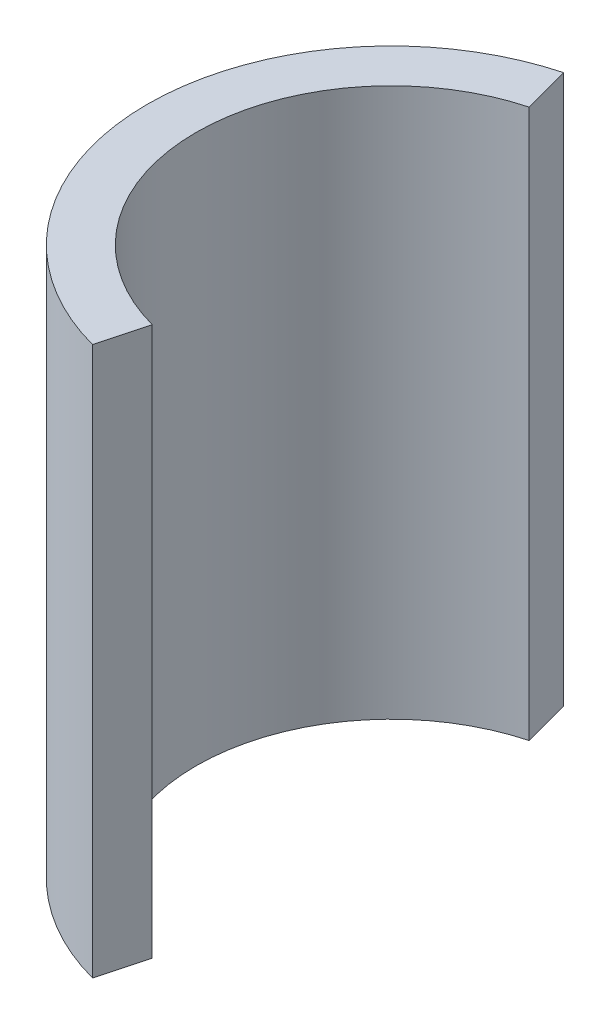
from build123d import *

# Parameters (mm, degrees)
BOSS_EXTRUDE1_DEPTH = 22.5


with BuildPart() as part:
    # Sketch1 → Boss-Extrude1 (new, symmetric)
    with BuildSketch(Plane(origin=(0, 0, 0), x_dir=(1, 0, 0), z_dir=(0, 1, 0))):
        with BuildLine():
            Line((-4.141104722, -15.454813221), (-5.176380902, -19.318516526))
            ThreePointArc((-5.176380902, -19.318516526), (-20, 0), (-5.176380902, 19.318516526))
            Line((-5.176380902, 19.318516526), (-4.141104722, 15.454813221))
            ThreePointArc((-4.141104722, 15.454813221), (-16, 0), (-4.141104722, -15.454813221))
        make_face()
    extrude(amount=BOSS_EXTRUDE1_DEPTH, both=True)


solid = part.part
